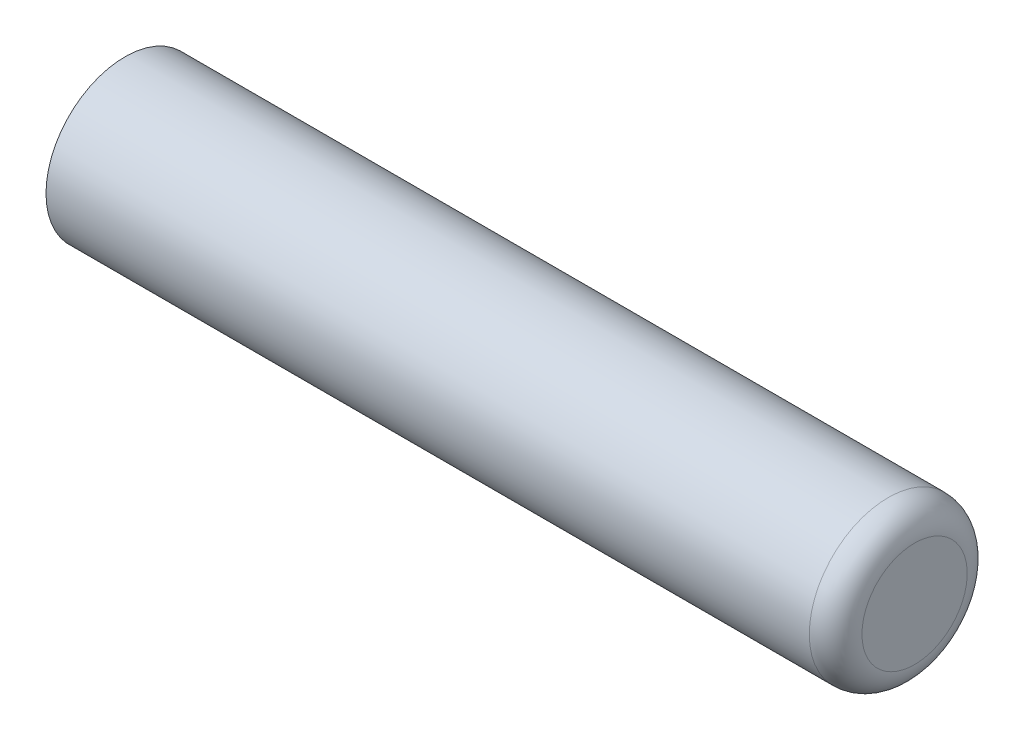
from build123d import *


with BuildPart() as part:
    # Sketch1 → Revolve1 (revolve)
    with BuildSketch(Plane(origin=(0, 0, 0), x_dir=(1, 0, 0), z_dir=(0, 1, 0))):
        with BuildLine():
            Line((-7.5, 1.5), (7, 1.5))
            ThreePointArc((7, 1.5), (7.353553391, 1.353553391), (7.5, 1))
            Line((7.5, 1), (7.5, 0))
            Line((7.5, 0), (-7.5, 0))
            Line((-7.5, 0), (-7.5, 1.5))
        make_face()
    revolve(axis=Axis((-7.5, 0, 0), (1, 0, 0)))


solid = part.part
